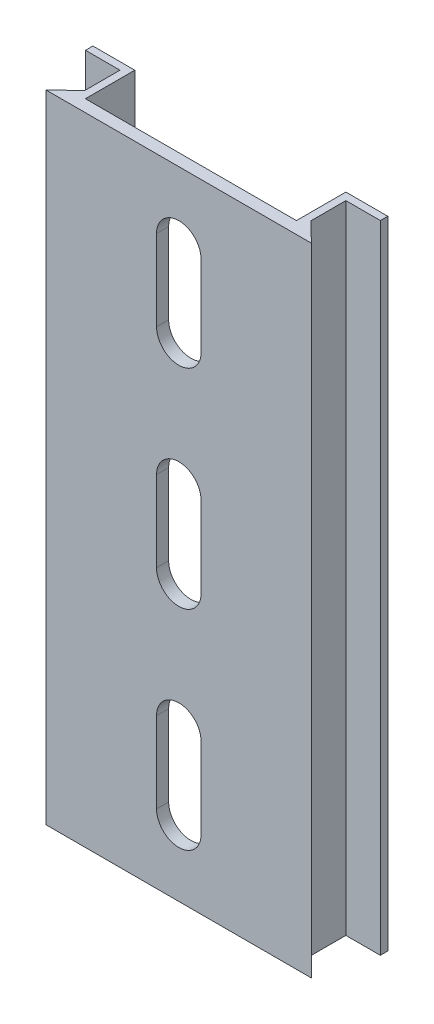
from build123d import *

# Parameters (mm, degrees)
BOSS_EXTRUDE1_DEPTH = 38.1
CUT_EXTRUDE1_DEPTH  = 43.632104862
LPATTERN1_COUNT     = 2
LPATTERN1_PITCH     = 25
LPATTERN1_COL_COUNT = 2
LPATTERN1_COL_PITCH = 25


with BuildPart() as part:
    # Sketch1 → Boss-Extrude1 (new, symmetric)
    with BuildSketch(Plane(origin=(0, 0, 0), x_dir=(1, 0, 0), z_dir=(0, 1, 0))):
        Polygon((-15.875, 0), (0, 0), (0, 1.4478), (-12.6365, 1.4478), (-12.6365, 7.366), (-17.653, 7.366), (-17.653, 6.477), (-13.5255, 6.477), (-13.5255, 2.286), align=None)
        Polygon((0, 1.4478), (0, 0), (15.875, 0), (13.5255, 2.286), (13.5255, 6.477), (17.653, 6.477), (17.653, 7.366), (12.6365, 7.366), (12.6365, 1.4478), align=None)
    extrude(amount=BOSS_EXTRUDE1_DEPTH, both=True)

    # Sketch2 → Cut-Extrude1 (cut, through all)
    with BuildSketch(Plane.XY):
        with BuildLine():
            Line((-2.667, -4.833), (-2.667, 4.833))
            ThreePointArc((-2.667, 4.833), (0, 7.5), (2.667, 4.833))
            Line((2.667, 4.833), (2.667, -4.833))
            ThreePointArc((2.667, -4.833), (0, -7.5), (-2.667, -4.833))
        make_face()
    cut_extrude1 = extrude(amount=-CUT_EXTRUDE1_DEPTH, mode=Mode.SUBTRACT)

    # LPattern1: Cut-Extrude1 ×2
    with Locations(*[(0, -i * LPATTERN1_PITCH, 0) for i in range(1, LPATTERN1_COUNT)]):
        add(cut_extrude1, mode=Mode.SUBTRACT)

    # LPattern1 col: Cut-Extrude1 ×2
    with Locations(*[(0, i * LPATTERN1_COL_PITCH, 0) for i in range(1, LPATTERN1_COL_COUNT)]):
        add(cut_extrude1, mode=Mode.SUBTRACT)


solid = part.part
